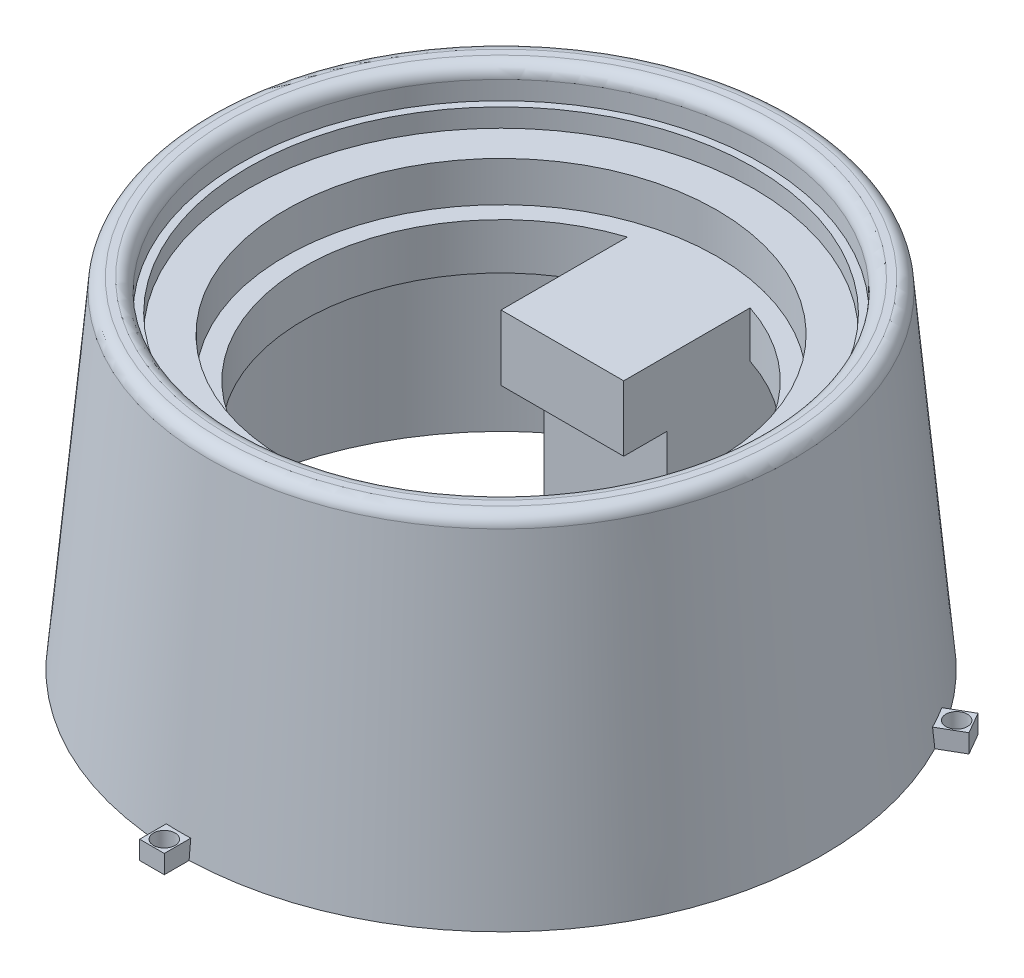
from build123d import *

# Parameters (mm, degrees)
SKETCH_1_R          = 52.22
SKETCH_1_R_2        = 47.22
SKETCH_1_R_3        = 42.22
EXTRUDE_1_DEPTH     = 50
SKETCH_3_R          = 52.22
SKETCH_3_R_2        = 47.22
SKETCH_3_R_3        = 42.22
EXTRUDE_2_DEPTH     = 5
CUT_EXTRUDE_1_REACH = 91.184
SKETCH_6_W          = 19.9
SKETCH_6_H          = 40.4
SKETCH_9_W          = 19.9
SKETCH_9_H          = 7
CUT_EXTRUDE_2_DEPTH = 29.9
SKETCH_13_W         = 10
SKETCH_13_H         = 10
CUT_EXTRUDE_3_DEPTH = 93.080708077
SKETCH_14_R         = 41
SKETCH_14_R_2       = 35
CUT_EXTRUDE_4_DEPTH = 3
CUT_EXTRUDE_5_DEPTH = 90.184397739
CUT_EXTRUDE_6_DEPTH = 33
SKETCH_21_R         = 35
CUT_EXTRUDE_7_DEPTH = 9.5
EXTRUDE_3_DEPTH     = 3
SKETCH_10_R         = 1.75
CUT_EXTRUDE_8_DEPTH = 10
FILLET_1_R          = 2
FILLET_2_R          = 2


with BuildPart() as part:
    # 草图1 → 凸台-拉伸1 (new body)
    # profile 1 of 3: a face of its own
    with BuildSketch(Plane(origin=(0, 0, 0), x_dir=(1, 0, 0), z_dir=(0, 1, 0))):
        with Locations(Location((0, 0, 0), (0, 0, 270))):
            Circle(SKETCH_1_R)
        Circle(SKETCH_1_R_2, mode=Mode.SUBTRACT)
    # profile 2 of 3: a face of its own
    with BuildSketch(Plane(origin=(0, 0, 0), x_dir=(1, 0, 0), z_dir=(0, 1, 0))):
        Circle(SKETCH_1_R_2)
        Circle(SKETCH_1_R_3, mode=Mode.SUBTRACT)
    # profile 3 of 3: a face of its own
    with BuildSketch(Plane(origin=(0, 0, 0), x_dir=(1, 0, 0), z_dir=(0, 1, 0))):
        Circle(SKETCH_1_R_3)
    extrude(amount=EXTRUDE_1_DEPTH)

    # 草图3 → 凸台-拉伸2 (add)
    # profile 1 of 2: a face of its own
    with BuildSketch(Plane(origin=(0, 50, 0), x_dir=(1, 0, 0), z_dir=(0, 1, 0))):
        with Locations(Location((0, 0, 0), (0, 0, 270))):
            Circle(SKETCH_3_R)
        Circle(SKETCH_3_R_2, mode=Mode.SUBTRACT)
    # profile 2 of 2: a face of its own
    with BuildSketch(Plane(origin=(0, 50, 0), x_dir=(1, 0, 0), z_dir=(0, 1, 0))):
        Circle(SKETCH_3_R_2)
        with Locations(Location((0, 0, 0), (0, 0, 270))):
            Circle(SKETCH_3_R_3, mode=Mode.SUBTRACT)
    extrude(amount=EXTRUDE_2_DEPTH)

    # 草图5 → 切除-旋转2 (revolve, cut)
    with BuildSketch(Plane(origin=(0, 0, 0), x_dir=(0, 0, -1), z_dir=(1, 0, 0)), mode=Mode.PRIVATE) as cut_revolve_2_sk:
        Polygon((52.22, 55), (52.22, 0), (47.22, 55), align=None)
    revolve(cut_revolve_2_sk.sketch.rotate(Axis((0, 58.85755821, 0), (0, -1, 0)), 180), axis=Axis((0, 58.85755821, 0), (0, -1, 0)), mode=Mode.SUBTRACT)

    # 草图6 → 切除-拉伸1 (cut, up to next)
    with BuildSketch(Plane(origin=(0, 50, 0), x_dir=(1, 0, 0), z_dir=(0, 1, 0)), mode=Mode.PRIVATE) as cut_extrude_1_sk1:
        with Locations((0, -10.25)):
            Rectangle(SKETCH_6_W, SKETCH_6_H)
    cut_extrude_1_tool1 = extrude(cut_extrude_1_sk1.sketch, amount=-CUT_EXTRUDE_1_REACH, mode=Mode.PRIVATE) & part.part
    add(cut_extrude_1_tool1.solids().sort_by_distance((0, 50, 10.25))[0], mode=Mode.SUBTRACT)

    # 草图9 → 切除-拉伸2 (cut)
    with BuildSketch(Plane.XZ):
        with Locations((0, 33.95)):
            Rectangle(SKETCH_9_W, SKETCH_9_H)
        with Locations((0, -13.45)):
            Rectangle(SKETCH_9_W, SKETCH_9_H)
    extrude(amount=-CUT_EXTRUDE_2_DEPTH, mode=Mode.SUBTRACT)

    # 草图13 → 切除-拉伸3 (cut, through all)
    with BuildSketch(Plane.XY):
        with Locations((0, 5)):
            Rectangle(SKETCH_13_W, SKETCH_13_H)
    extrude(amount=-CUT_EXTRUDE_3_DEPTH, mode=Mode.SUBTRACT)

    # 草图14 → 切除-拉伸4 (cut)
    with BuildSketch(Plane(origin=(0, 50, 0), x_dir=(1, 0, 0), z_dir=(0, 1, 0))):
        with Locations(Location((0, 0, 0), (0, 0, 270))):
            Circle(SKETCH_14_R)
        with Locations(Location((0, 0, 0), (0, 0, 270))):
            Circle(SKETCH_14_R_2, mode=Mode.SUBTRACT)
    extrude(amount=-CUT_EXTRUDE_4_DEPTH, mode=Mode.SUBTRACT)

    # 草图15 → 切除-拉伸5 (cut, through all)
    with BuildSketch(Plane(origin=(0, 50, 0), x_dir=(1, 0, 0), z_dir=(0, 1, 0))):
        with BuildLine():
            Line((-9.95, -30.45), (-9.95, 9.95))
            Line((-9.95, 9.95), (-9.95, 30.45))
            ThreePointArc((-9.95, 30.45), (-32.034434598, 0), (-9.95, -30.45))
        make_face()
        with BuildLine():
            Line((9.95, 30.45), (9.95, 9.95))
            Line((9.95, 9.95), (9.95, -30.45))
            ThreePointArc((9.95, -30.45), (25.932100033, -18.807742764), (32.034434598, 0))
            ThreePointArc((32.034434598, 0), (25.932100033, 18.807742764), (9.95, 30.45))
        make_face()
    extrude(amount=-CUT_EXTRUDE_5_DEPTH, mode=Mode.SUBTRACT)

    # 草图17 → 切除-拉伸6 (cut)
    with BuildSketch(Plane.XZ):
        with BuildLine():
            ThreePointArc((-9.95, -30.45), (-32.034434598, 0), (-9.95, 30.45))
            Line((-9.95, 30.45), (-9.95, 37.45))
            Line((-9.95, 37.45), (-9.95, 41.030792096))
            ThreePointArc((-9.95, 41.030792096), (-42.22, 0), (-9.95, -41.030792096))
            Line((-9.95, -41.030792096), (-9.95, -30.45))
        make_face()
        with BuildLine():
            Line((-9.95, -46.159786611), (-9.95, -41.030792096))
            ThreePointArc((-9.95, -41.030792096), (-42.22, 0), (-9.95, 41.030792096))
            Line((-9.95, 41.030792096), (-9.95, 46.159786611))
            ThreePointArc((-9.95, 46.159786611), (-47.22, 0), (-9.95, -46.159786611))
        make_face()
        with BuildLine():
            Line((9.95, -30.45), (9.95, -41.030792096))
            ThreePointArc((9.95, -41.030792096), (33.185971434, -26.100185823), (42.22, 0))
            ThreePointArc((42.22, 0), (33.185971434, 26.100185823), (9.95, 41.030792096))
            Line((9.95, 41.030792096), (9.95, 37.45))
            Line((9.95, 37.45), (9.95, 30.45))
            ThreePointArc((9.95, 30.45), (32.034434598, 0), (9.95, -30.45))
        make_face()
        with BuildLine():
            ThreePointArc((42.22, 0), (33.185971434, -26.100185823), (9.95, -41.030792096))
            Line((9.95, -41.030792096), (9.95, -46.159786611))
            ThreePointArc((9.95, -46.159786611), (36.739402554, -29.663861852), (47.22, 0))
            ThreePointArc((47.22, 0), (36.739402554, 29.663861852), (9.95, 46.159786611))
            Line((9.95, 46.159786611), (9.95, 41.030792096))
            ThreePointArc((9.95, 41.030792096), (33.185971434, 26.100185823), (42.22, 0))
        make_face()
    extrude(amount=-CUT_EXTRUDE_6_DEPTH, mode=Mode.SUBTRACT)

    # 草图21 → 切除-拉伸7 (cut)
    with BuildSketch(Plane(origin=(0, 50, 0), x_dir=(1, 0, 0), z_dir=(0, 1, 0))):
        with Locations(Location((0, 0, 0), (0, 0, 270))):
            Circle(SKETCH_21_R)
    extrude(amount=-CUT_EXTRUDE_7_DEPTH, mode=Mode.SUBTRACT)

    # 草图22 → 凸台-拉伸3 (add)
    with BuildSketch(Plane.XZ):
        with BuildLine():
            ThreePointArc((-2.41619928, 52.164071745), (-1.416459213, 52.200785849), (-0.41619928, 52.218341396))
            Line((-0.41619928, 52.218341396), (-0.41619928, 52.468341396))
            ThreePointArc((-0.41619928, 52.468341396), (-2.16619928, 54.218341396), (-0.41619928, 55.968341396))
            Line((-0.41619928, 55.968341396), (-0.41619928, 56.218341396))
            Line((-0.41619928, 56.218341396), (-2.41619928, 56.218341396))
            Line((-2.41619928, 56.218341396), (-2.41619928, 52.164071745))
        make_face()
        with BuildLine():
            Line((-0.41619928, 52.468341396), (-0.41619928, 52.218341396))
            ThreePointArc((-0.41619928, 52.218341396), (0.583907806, 52.21673536), (1.58380072, 52.19597662))
            Line((1.58380072, 52.19597662), (1.58380072, 56.218341396))
            Line((1.58380072, 56.218341396), (-0.41619928, 56.218341396))
            Line((-0.41619928, 56.218341396), (-0.41619928, 55.968341396))
            ThreePointArc((-0.41619928, 55.968341396), (0.821237587, 55.455778263), (1.33380072, 54.218341396))
            ThreePointArc((1.33380072, 54.218341396), (0.821237587, 52.980904529), (-0.41619928, 52.468341396))
        make_face()
        with BuildLine():
            Line((-0.41619928, 52.218341396), (-0.400258549, 50.218341396))
            Line((-0.400258549, 50.218341396), (1.58380072, 50.218341396))
            Line((1.58380072, 50.218341396), (1.58380072, 52.19597662))
            ThreePointArc((1.58380072, 52.19597662), (0.583907806, 52.21673536), (-0.41619928, 52.218341396))
        make_face()
        with BuildLine():
            Line((-2.41619928, 50.218341396), (-0.400258549, 50.218341396))
            Line((-0.400258549, 50.218341396), (-0.41619928, 52.218341396))
            ThreePointArc((-0.41619928, 52.218341396), (-1.416459213, 52.200785849), (-2.41619928, 52.164071745))
            Line((-2.41619928, 52.164071745), (-2.41619928, 50.218341396))
        make_face()
        with BuildLine():
            ThreePointArc((46.383510936, -23.989545915), (45.915436249, -24.873703263), (45.430509833, -25.748731548))
            Line((45.430509833, -25.748731548), (45.647016184, -25.873731548))
            ThreePointArc((45.647016184, -25.873731548), (47.615493969, -25.058361352), (48.91256064, -26.748731548))
            ThreePointArc((48.91256064, -26.748731548), (48.852930836, -27.201664877), (48.678105097, -27.623731548))
            Line((48.678105097, -27.623731548), (48.894611448, -27.748731548))
            Line((48.894611448, -27.748731548), (49.894611448, -26.016680741))
            Line((49.894611448, -26.016680741), (46.383510936, -23.989545915))
        make_face()
        with BuildLine():
            Line((44.698459025, -23.016680741), (43.690488659, -24.762536627))
            Line((43.690488659, -24.762536627), (45.430509833, -25.748731548))
            ThreePointArc((45.430509833, -25.748731548), (45.915436249, -24.873703263), (46.383510936, -23.989545915))
            Line((46.383510936, -23.989545915), (44.698459025, -23.016680741))
        make_face()
        with BuildLine():
            Line((45.430509833, -25.748731548), (43.690488659, -24.762536627))
            Line((43.690488659, -24.762536627), (42.698459025, -26.480782356))
            Line((42.698459025, -26.480782356), (44.411141368, -27.469599967))
            ThreePointArc((44.411141368, -27.469599967), (44.929065422, -26.614046674), (45.430509833, -25.748731548))
        make_face()
        with BuildLine():
            Line((45.647016184, -25.873731548), (45.430509833, -25.748731548))
            ThreePointArc((45.430509833, -25.748731548), (44.929065422, -26.614046674), (44.411141368, -27.469599967))
            Line((44.411141368, -27.469599967), (47.894611448, -29.480782356))
            Line((47.894611448, -29.480782356), (48.894611448, -27.748731548))
            Line((48.894611448, -27.748731548), (48.678105097, -27.623731548))
            ThreePointArc((48.678105097, -27.623731548), (46.28756064, -28.264276005), (45.647016184, -25.873731548))
        make_face()
        with BuildLine():
            Line((-45.230816903, -26.594609848), (-45.014310552, -26.469609848))
            ThreePointArc((-45.014310552, -26.469609848), (-45.512973228, -25.602688687), (-45.994942088, -24.726376652))
            Line((-45.994942088, -24.726376652), (-49.478412167, -26.73755904))
            Line((-49.478412167, -26.73755904), (-48.478412167, -28.469609848))
            Line((-48.478412167, -28.469609848), (-48.261905816, -28.344609848))
            ThreePointArc((-48.261905816, -28.344609848), (-47.62136136, -25.954065391), (-45.230816903, -26.594609848))
        make_face()
        with BuildLine():
            Line((-45.014310552, -26.469609848), (-43.29023011, -25.45580477))
            Line((-43.29023011, -25.45580477), (-44.282259745, -23.73755904))
            Line((-44.282259745, -23.73755904), (-45.994942088, -24.726376652))
            ThreePointArc((-45.994942088, -24.726376652), (-45.512973228, -25.602688687), (-45.014310552, -26.469609848))
        make_face()
        with BuildLine():
            Line((-42.282259745, -27.201660656), (-43.29023011, -25.45580477))
            Line((-43.29023011, -25.45580477), (-45.014310552, -26.469609848))
            ThreePointArc((-45.014310552, -26.469609848), (-44.498977037, -27.327082586), (-43.967311656, -28.17452583))
            Line((-43.967311656, -28.17452583), (-42.282259745, -27.201660656))
        make_face()
        with BuildLine():
            ThreePointArc((-43.967311656, -28.17452583), (-44.498977037, -27.327082586), (-45.014310552, -26.469609848))
            Line((-45.014310552, -26.469609848), (-45.230816903, -26.594609848))
            ThreePointArc((-45.230816903, -26.594609848), (-45.055991164, -27.016676519), (-44.99636136, -27.469609848))
            ThreePointArc((-44.99636136, -27.469609848), (-46.293428031, -29.159980044), (-48.261905816, -28.344609848))
            Line((-48.261905816, -28.344609848), (-48.478412167, -28.469609848))
            Line((-48.478412167, -28.469609848), (-47.478412167, -30.201660656))
            Line((-47.478412167, -30.201660656), (-43.967311656, -28.17452583))
        make_face()
    extrude(amount=-EXTRUDE_3_DEPTH)

    # 草图10 → 切除-拉伸8 (cut)
    with BuildSketch(Plane.XZ.offset(-29.9)):
        with Locations(Location((4.95, 34.55, 0), (0, 0, 270))):
            Circle(SKETCH_10_R)
        with Locations(Location((-4.95, 34.55, 0), (0, 0, 270))):
            Circle(SKETCH_10_R)
        with Locations(Location((-4.95, -14.05, 0), (0, 0, 270))):
            Circle(SKETCH_10_R)
        with Locations(Location((4.95, -14.05, 0), (0, 0, 270))):
            Circle(SKETCH_10_R)
    extrude(amount=-CUT_EXTRUDE_8_DEPTH, mode=Mode.SUBTRACT)

    # 圆角1
    fillet_1_edges = [part.edges().sort_by_distance(p)[0] for p in [
        (0, 55, -47.22),
    ]]
    fillet(fillet_1_edges, radius=FILLET_1_R)

    # 圆角2
    fillet_2_edges = [part.edges().sort_by_distance(p)[0] for p in [
        (0, 55, -42.22),
    ]]
    fillet(fillet_2_edges, radius=FILLET_2_R)


solid = part.part
